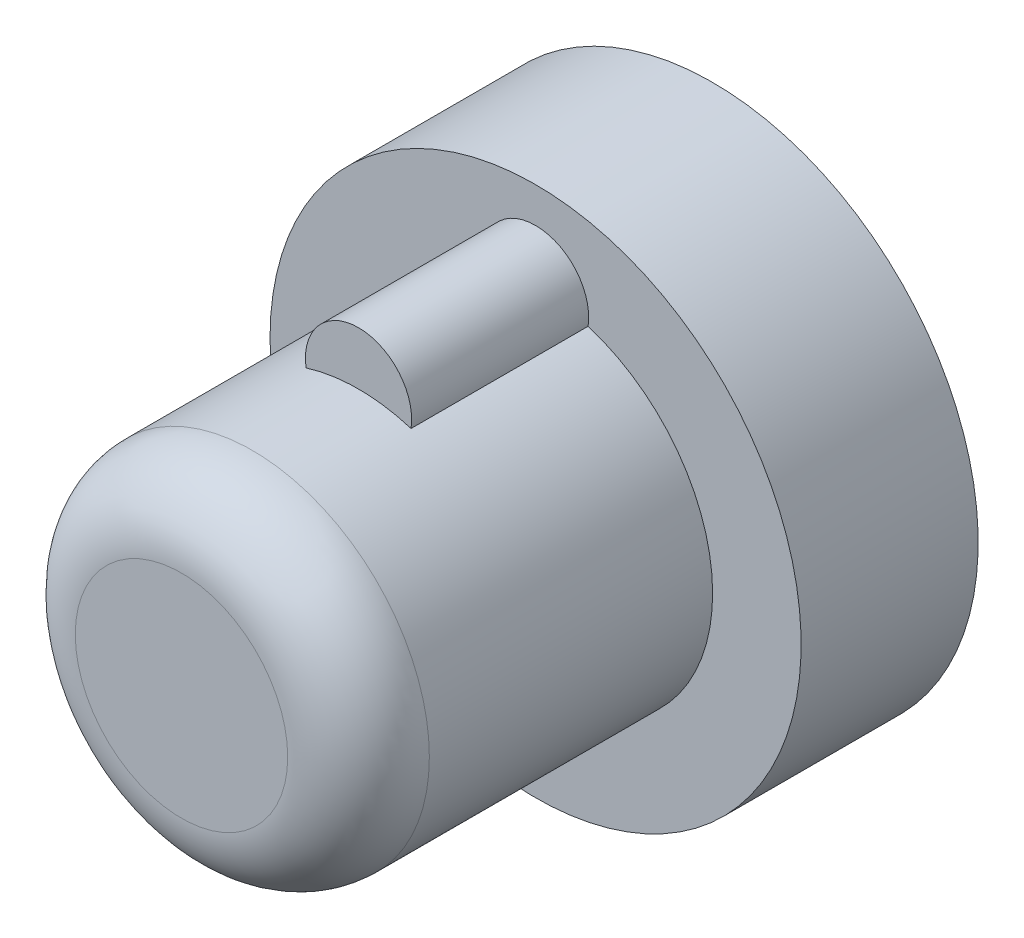
from build123d import *

# Parameters (mm, degrees)
SKETCH_1_R      = 5
EXTRUDE_1_DEPTH = 10
SKETCH_2_R      = 7.5
EXTRUDE_2_DEPTH = 5
FILLET_1_R      = 2
SKETCH_5_R      = 1.5
EXTRUDE_4_DEPTH = 5


with BuildPart() as part:
    # 草图1 → 凸台-拉伸1 (new body)
    with BuildSketch(Plane.XY):
        Circle(SKETCH_1_R)
    extrude(amount=EXTRUDE_1_DEPTH)

    # 草图2 → 凸台-拉伸2 (add)
    with BuildSketch(Plane(origin=(0, 0, 0), x_dir=(-1, 0, 0), z_dir=(0, 0, -1))):
        Circle(SKETCH_2_R)
    extrude(amount=EXTRUDE_2_DEPTH)

    # 圆角1
    fillet_1_edges = [part.edges().sort_by_distance(p)[0] for p in [
        (-5, 0, 10),
    ]]
    fillet(fillet_1_edges, radius=FILLET_1_R)

    # 草图5 → 凸台-拉伸4 (add)
    with BuildSketch(Plane.XY):
        with Locations((0, 5)):
            Circle(SKETCH_5_R)
    extrude(amount=EXTRUDE_4_DEPTH)


solid = part.part
